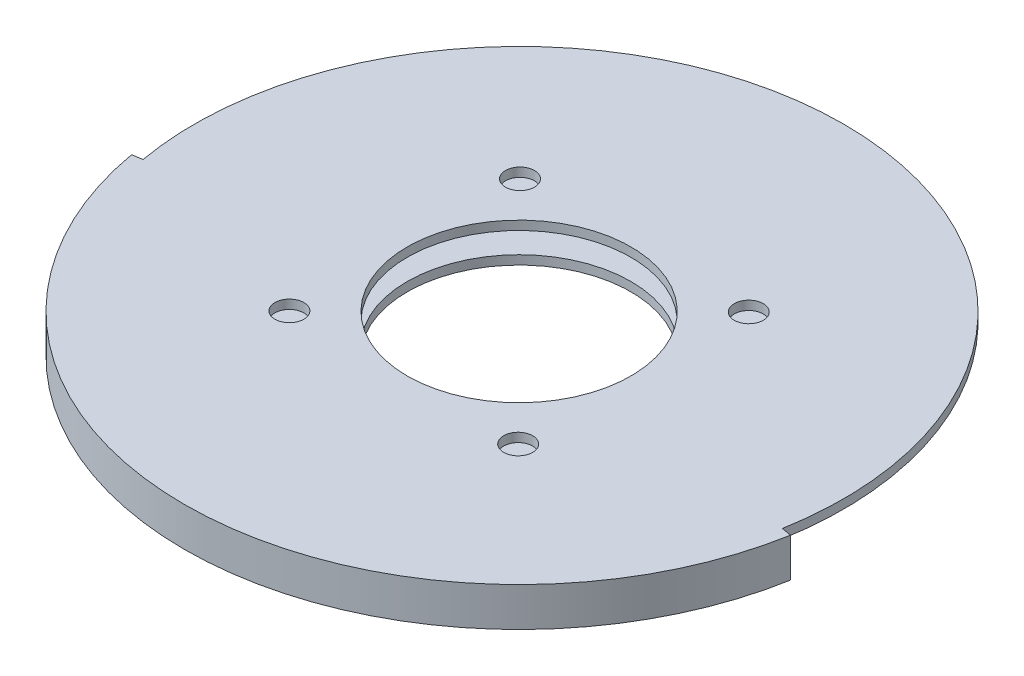
from build123d import *

# Parameters (mm, degrees)
SKETCH_1_R          = 32.5
EXTRUDE_1_DEPTH     = 0.9
EXTRUDE_START       = -3.9
EXTRUDE_1_2_DEPTH   = 3.9
SKETCH_3_R          = 29
EXTRUDE_2_DEPTH     = 0.9
EXTRUDE_2_2_DEPTH   = 0.9
SKETCH_5_R          = 1.45
SKETCH_5_R_2        = 11.2
CUT_EXTRUDE_1_DEPTH = 3.9


with BuildPart() as part:
    # 草图1 → Extrude 1 (new body)
    with BuildSketch(Plane(origin=(0, 477.404389455, 0), x_dir=(1, 0, 0), z_dir=(0, 1, 0))):
        with Locations(Location((0, 0, 0), (0, 0, 270))):
            Circle(SKETCH_1_R)
    extrude(amount=EXTRUDE_1_DEPTH)

    # 草图2 → Extrude 1 2 (add)
    with BuildSketch(Plane(origin=(0, 478.304389455, 0), x_dir=(1, 0, 0), z_dir=(0, 1, 0)).offset(EXTRUDE_START)):
        with BuildLine():
            ThreePointArc((-32.006251973, -5.643565774), (0, -32.5), (32.006251973, -5.643565774))
            Line((32.006251973, -5.643565774), (32.991059726, -5.817213952))
            ThreePointArc((32.991059726, -5.817213952), (0, -33.5), (-32.991059726, -5.817213952))
            Line((-32.991059726, -5.817213952), (-32.006251973, -5.643565774))
        make_face()
    extrude(amount=EXTRUDE_1_2_DEPTH)



with BuildPart() as body_2:
    # 草图3 → Extrude 2 (new body)
    with BuildSketch(Plane.XZ.offset(-474.404389455)):
        with Locations(Location((0, 0, 0), (0, 0, 270))):
            Circle(SKETCH_3_R)
    extrude(amount=-EXTRUDE_2_DEPTH)


with BuildPart() as part_1:
    add(part.part)

    add(body_2.part)  # Extrude 2 2 merges body 2
    # 草图4 → Extrude 2 2 (add)
    with BuildSketch(Plane.XZ.offset(-474.404389455)):
        with BuildLine():
            ThreePointArc((32.006251973, 5.643565774), (0, 32.5), (-32.006251973, 5.643565774))
            Line((-32.006251973, 5.643565774), (-28.559424837, 5.035797152))
            ThreePointArc((-28.559424837, 5.035797152), (0, 29), (28.559424837, 5.035797152))
            Line((28.559424837, 5.035797152), (32.006251973, 5.643565774))
        make_face()
    extrude(amount=-EXTRUDE_2_2_DEPTH)

    # 草图5 → 切除-拉伸1 (cut)
    with BuildSketch(Plane(origin=(0, 478.304389455, 0), x_dir=(1, 0, 0), z_dir=(0, 1, 0))):
        with Locations(Location((11.545745571, 11.45407173, 0), (0, 0, 270))):
            Circle(SKETCH_5_R)
        with Locations(Location((11.45407173, -11.545745571, 0), (0, 0, 270))):
            Circle(SKETCH_5_R)
        with Locations(Location((-11.545745571, -11.45407173, 0), (0, 0, 270))):
            Circle(SKETCH_5_R)
        with Locations(Location((-11.45407173, 11.545745571, 0), (0, 0, 270))):
            Circle(SKETCH_5_R)
        with Locations(Location((0, 0, 0), (0, 0, 270))):
            Circle(SKETCH_5_R_2)
    extrude(amount=-CUT_EXTRUDE_1_DEPTH, mode=Mode.SUBTRACT)


solid = part_1.part
